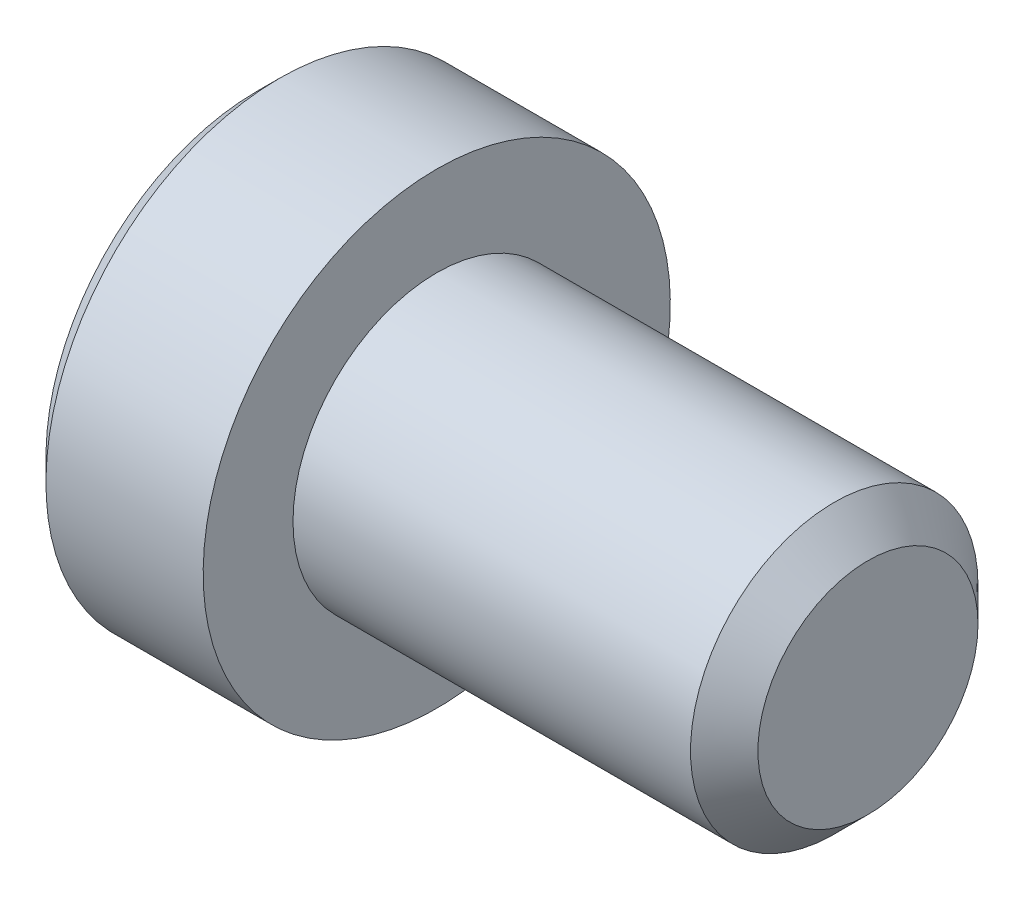
from build123d import *

# Parameters (mm, degrees)
SKETCH2_R           = 4
BOSS_EXTRUDE1_DEPTH = 12
CHAMFER1_SIZE       = 0.9375
CUT_EXTRUDE1_DEPTH  = 3.95


with BuildPart() as part:
    # Sketch2 → Boss-Extrude1 (new body)
    with BuildSketch(Plane(origin=(6, 0, 0), x_dir=(0, 0, -1), z_dir=(1, 0, 0))):
        Circle(SKETCH2_R)
    extrude(amount=-BOSS_EXTRUDE1_DEPTH)

    # Chamfer1
    chamfer1_edges = [part.edges().sort_by_distance(p)[0] for p in [
        (6, 0, 4),
    ]]
    chamfer(chamfer1_edges, length=CHAMFER1_SIZE)

    # Sketch6 → Revolve1 (revolve)
    with BuildSketch(Plane.XY):
        Polygon((-10.375, 6.5), (-11, 5.875), (-11, 0), (-6, 0), (-6, 6.5), align=None)
    revolve(axis=Axis((-6, 0, 0), (-1, 0, 0)))

    # Sketch4 → Cut-Extrude1 (cut)
    with BuildSketch(Plane(origin=(-11, 0, 0), x_dir=(0, 0, -1), z_dir=(1, 0, 0))):
        Polygon((0, 2.886751346), (-2.5, 1.443375673), (-2.5, -1.443375673), (0, -2.886751346), (2.5, -1.443375673), (2.5, 1.443375673), align=None)
    extrude(amount=CUT_EXTRUDE1_DEPTH, mode=Mode.SUBTRACT)

    # Cut-Extrude2 cone 1 section (through the dimple's axis) → Cut-Extrude2 (revolve, cut)
    with BuildSketch(Plane(origin=(-11, 0, 0), x_dir=(0, 0, 1), z_dir=(0, 1, 0))):
        Polygon((0, 0), (2.886751346, 0), (0, 2.886751346), align=None)
    revolve(axis=Axis((-11, 0, 0), (1, 0, 0)), mode=Mode.SUBTRACT)


solid = part.part
